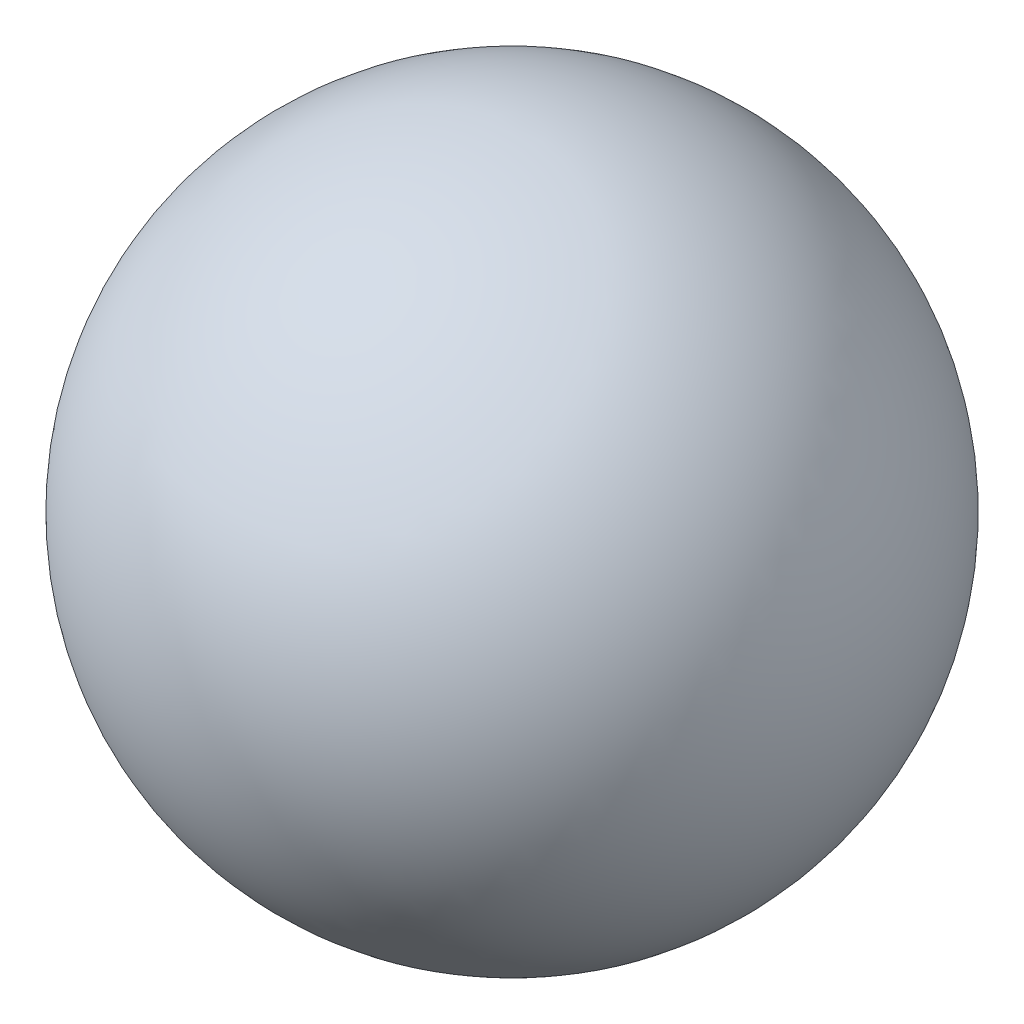
from build123d import *
from build123d.topology import SkipClean


with BuildPart() as part:
    # 草图1 → 旋转3 (revolve)
    with SkipClean():  # the faces are left unmerged after this step: merging them gives an invalid solid
        with BuildSketch(Plane.XY):
            with BuildLine():
                ThreePointArc((21, 0), (14.849242405, 14.849242405), (0, 21))
                Line((0, 21), (0, -21))
                ThreePointArc((0, -21), (14.849242405, -14.849242405), (21, 0))
            make_face()
            with BuildLine():
                Line((0, -21), (0, 21))
                ThreePointArc((0, 21), (-21, 0), (0, -21))
            make_face()
        revolve(axis=Axis((0, 25.142786861, 0), (0, -1, 0)))


solid = part.part
